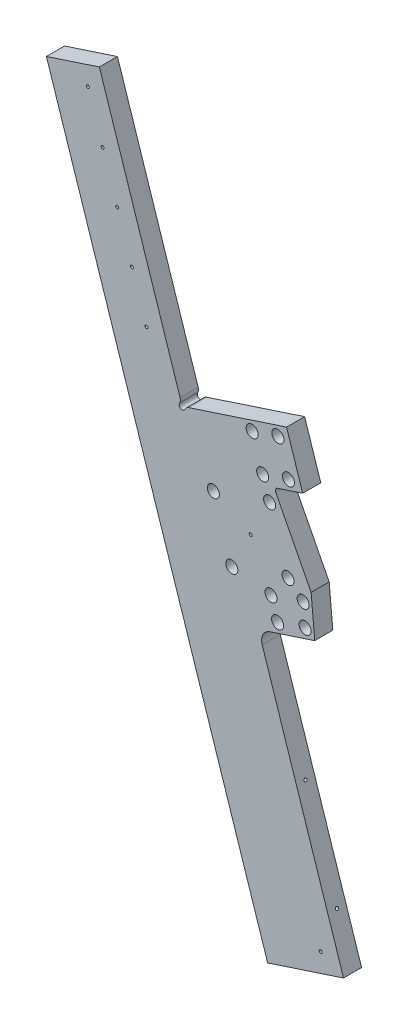
from build123d import *

# Parameters (mm, degrees)
BOSS_EXTRUDE1_DEPTH        = 19.05
BOSS_EXTRUDE2_DEPTH        = 19.05
FILLET1_R                  = 3.175
FILLET2_R                  = 12.7
CUT_EXTRUDE1_DEPTH         = 965.552600368
CUT_EXTRUDE1_DEPTH_BACK    = 965.552600368
SKETCH47_R                 = 3.175
FILLET4_R                  = 6.35
F_1_2_0_5_DIAMETER_HOLE1_D = 12.7
HOLE7_D                    = 3.175
HOLE7_DEPTH                = 38.1
HOLE7_CSINK_D              = 10.16
HOLE7_CSINK_ANGLE          = 82
HOLE7_TIP                  = 0.953866233
HOLE10_D                   = 3.175
HOLE10_DEPTH               = 57.15
HOLE10_CSINK_D             = 10.16
HOLE10_CSINK_ANGLE         = 82
HOLE10_TIP                 = 0.953866233
HOLE13_D                   = 3.175
HOLE13_DEPTH               = 31.75
HOLE13_CSINK_D             = 10.16
HOLE13_CSINK_ANGLE         = 82
HOLE13_TIP                 = 0.953866233


with BuildPart() as part:
    # Sketch1 → Boss-Extrude1 (new body)
    with BuildSketch(Plane.XY):
        Polygon((-247.274665566, 82.142339986), (-327.22102196, 55.917162383), (-560.337153612, 766.561933763), (-504.525442447, 784.870110692), (-417.251419261, 518.818903446), (-393.116774032, 526.735904121), align=None)
    extrude(amount=-BOSS_EXTRUDE1_DEPTH)

    # Sketch2 → Boss-Extrude2 (add, through all)
    with BuildSketch(Plane.XY):
        Polygon((-393.116774032, 526.735904121), (-336.901176267, 355.36500697), (-277.604402796, 374.816405204), (-281.415155825, 417.005352091), (-320.44916939, 493.083731154), (-290.280862854, 502.979981998), (-307.307307279, 554.884385267), align=None)
    extrude(amount=-BOSS_EXTRUDE2_DEPTH)

    # Fillet1
    fillet1_edges = [part.edges().sort_by_distance(p)[0] for p in [
        (-320.44916939, 493.083731154, -9.525),
    ]]
    fillet(fillet1_edges, radius=FILLET1_R)

    # Fillet2
    fillet2_edges = [part.edges().sort_by_distance(p)[0] for p in [
        (-336.901176267, 355.36500697, -9.525),
    ]]
    fillet(fillet2_edges, radius=FILLET2_R)

    # Sketch47 → Cut-Extrude1 (cut, two sides: drawn at the far end of the back side and taken through both)
    with BuildSketch(Plane(origin=(0, 0, -19.05), x_dir=(-1, 0, 0), z_dir=(0, 0, -1)).offset(-CUT_EXTRUDE1_DEPTH_BACK)):
        with Locations((417.251419261, 518.818903446)):
            Circle(SKETCH47_R)
    extrude(amount=CUT_EXTRUDE1_DEPTH + CUT_EXTRUDE1_DEPTH_BACK, mode=Mode.SUBTRACT)

    # Fillet4
    fillet4_edges = [part.edges().sort_by_distance(p)[0] for p in [
        (-418.241044345, 521.8357341, -9.525),
        (-414.234588607, 519.80852853, -9.525),
    ]]
    fillet(fillet4_edges, radius=FILLET4_R)

    # 1/2 (0.5) Diameter Hole1 (through all)
    with Locations(Plane.XY):
        with Locations((-563.45033927, 698.544682362), (-504.072834209, 517.534843147), (-316.771364786, 371.99266929), (-323.698740376, 393.110483865), (-289.824308357, 404.222472403), (-287.772364418, 381.505347156), (-305.715281117, 417.978415836), (-364.985283482, 398.535799453), (-384.427899865, 457.805801818), (-325.157897499, 477.248418201), (-332.468536604, 499.165347862), (-305.317060721, 508.071973621), (-316.40575464, 541.875392969), (-343.557230523, 532.968767209)):
            Hole(F_1_2_0_5_DIAMETER_HOLE1_D / 2)

    # Hole7
    with Locations(Plane(origin=(313.774034822, -375.700785937, 19.05), x_dir=(0.9977564584489053, -0.06694811142592419, 0), z_dir=(0, 0, 1))):
        with Locations((-710.914924699, 391.126528253), (-615.24080496, 429.781381762), (-711.83598555, 767.659094962), (-835.937309391, 717.51890547), (-904.68821492, 1078.38439498), (-976.811864753, 1049.244548945)):
            CounterSinkHole(HOLE7_D / 2, HOLE7_CSINK_D / 2, depth=HOLE7_DEPTH, counter_sink_angle=HOLE7_CSINK_ANGLE)
            with Locations((0, 0, -(HOLE7_DEPTH + HOLE7_TIP / 2))):  # 118° drill point
                Cone(0, HOLE7_D / 2, HOLE7_TIP, mode=Mode.SUBTRACT)

    # Hole10
    with Locations(Plane(origin=(313.774034822, -375.700785937, -57.15), x_dir=(-0.9977564584489053, 0.06694811142592419, 0), z_dir=(0, 0, -1))):
        with Locations((848.944412528, 940.413642522), (885.927448463, 1031.949868564), (867.435930496, 986.181755543), (830.452894561, 894.645529501)):
            CounterSinkHole(HOLE10_D / 2, HOLE10_CSINK_D / 2, depth=HOLE10_DEPTH, counter_sink_angle=HOLE10_CSINK_ANGLE)
            with Locations((0, 0, -(HOLE10_DEPTH + HOLE10_TIP / 2))):  # 118° drill point
                Cone(0, HOLE10_D / 2, HOLE10_TIP, mode=Mode.SUBTRACT)

    # Hole13
    with Locations(Plane(origin=(-45.102820315, -493.424841018, 52.974999997), x_dir=(0, 0, -1), z_dir=(0.9501828830204607, 0.3116929399504029, 1.2476428765784286e-15))):
        with Locations((174.999999994, 685.961004241), (174.999999994, 549.837259632), (174.999999994, 413.713515022), (81.549999997, 779.649723129), (81.549999997, 652.344645962), (62.499999997, 662.953402392), (62.499999997, 769.040966698), (-62.499999997, 769.040966698), (-62.499999997, 662.953402392), (-81.549999997, 652.344645962), (-81.549999997, 779.649723129), (-174.999999994, 413.713515022), (-174.999999994, 549.837259632), (-174.999999994, 685.961004241), (-82.737499997, 600.384620239), (0, 600.384620239), (82.737499997, 600.384620239), (0, 376.737770337), (-82.737499997, 376.737770337), (82.737499997, 376.737770337)):
            CounterSinkHole(HOLE13_D / 2, HOLE13_CSINK_D / 2, depth=HOLE13_DEPTH, counter_sink_angle=HOLE13_CSINK_ANGLE)
            with Locations((0, 0, -(HOLE13_DEPTH + HOLE13_TIP / 2))):  # 118° drill point
                Cone(0, HOLE13_D / 2, HOLE13_TIP, mode=Mode.SUBTRACT)


solid = part.part
